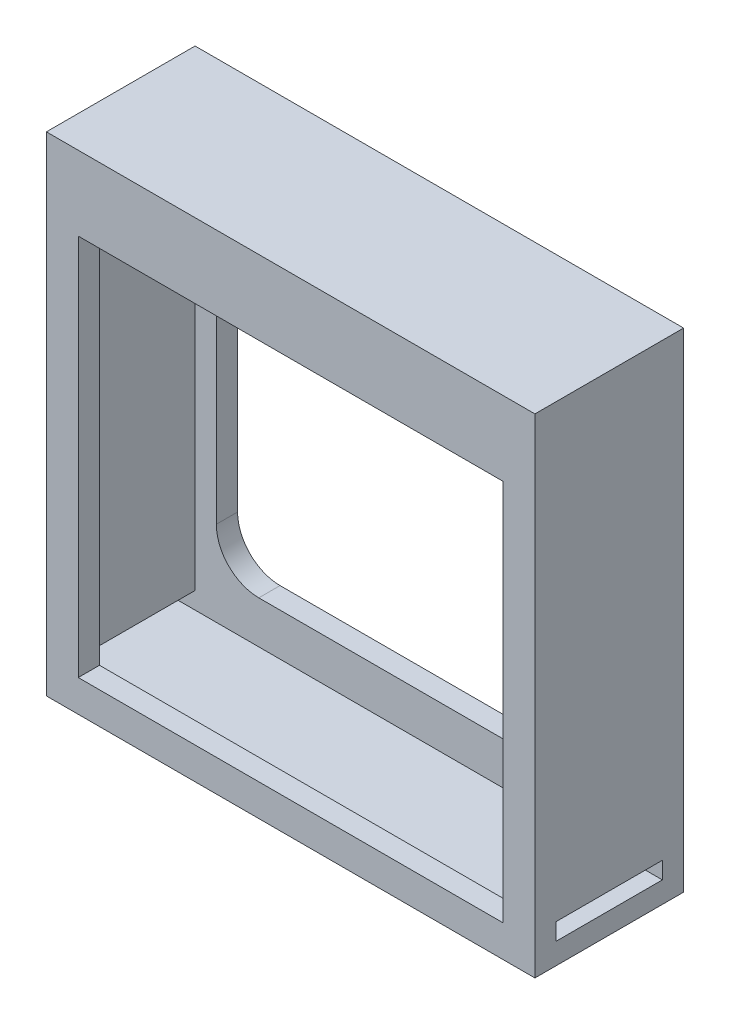
from build123d import *

# Parameters (mm, degrees)
SKETCH1_W               = 115
SKETCH1_H               = 115
BOSS_EXTRUDE1_DEPTH     = 35
SHELL2_T                = 5
SKETCH4_W               = 100
SKETCH4_H               = 90
CUT_EXTRUDE1_DEPTH      = 30
SKETCH5_W               = 95
SKETCH5_H               = 90
CUT_EXTRUDE2_DEPTH      = 30
FILLET1_R               = 10
CUT_EXTRUDE3_DEPTH      = 129.962203765
CUT_EXTRUDE3_DEPTH_BACK = 129.962203765
SKETCH9_W               = 25
SKETCH9_H               = 4


with BuildPart() as part:
    # Sketch1 → Boss-Extrude1 (new body)
    with BuildSketch(Plane.XY):
        Rectangle(SKETCH1_W, SKETCH1_H)
    extrude(amount=BOSS_EXTRUDE1_DEPTH)

    # Shell2 (no face opened: a closed hollow body)
    add(offset(amount=-SHELL2_T, mode=Mode.PRIVATE), mode=Mode.SUBTRACT)

    # Sketch4 → Cut-Extrude1 (cut)
    with BuildSketch(Plane.XY.offset(35)):
        with Locations((0, -5)):
            Rectangle(SKETCH4_W, SKETCH4_H)
    extrude(amount=-CUT_EXTRUDE1_DEPTH, mode=Mode.SUBTRACT)

    # Sketch5 → Cut-Extrude2 (cut)
    with BuildSketch(Plane(origin=(0, 0, 0), x_dir=(-1, 0, 0), z_dir=(0, 0, -1))):
        with Locations((0, 2.5)):
            Rectangle(SKETCH5_W, SKETCH5_H)
    extrude(amount=-CUT_EXTRUDE2_DEPTH, mode=Mode.SUBTRACT)

    # Fillet1
    fillet1_edges = [part.edges().sort_by_distance(p)[0] for p in [
        (-47.5, -42.5, 2.5),
        (47.5, -42.5, 2.5),
        (47.5, 47.5, 2.5),
        (-47.5, 47.5, 2.5),
    ]]
    fillet(fillet1_edges, radius=FILLET1_R)

    # Sketch9 → Cut-Extrude3 (cut, two sides: drawn at the far end of the back side and taken through both)
    with BuildSketch(Plane(origin=(-52.5, 0, 0), x_dir=(0, 0, -1), z_dir=(1, 0, 0)).offset(-CUT_EXTRUDE3_DEPTH_BACK)):
        with Locations((-17.5, -50.5)):
            Rectangle(SKETCH9_W, SKETCH9_H)
    extrude(amount=CUT_EXTRUDE3_DEPTH + CUT_EXTRUDE3_DEPTH_BACK, mode=Mode.SUBTRACT)


solid = part.part
